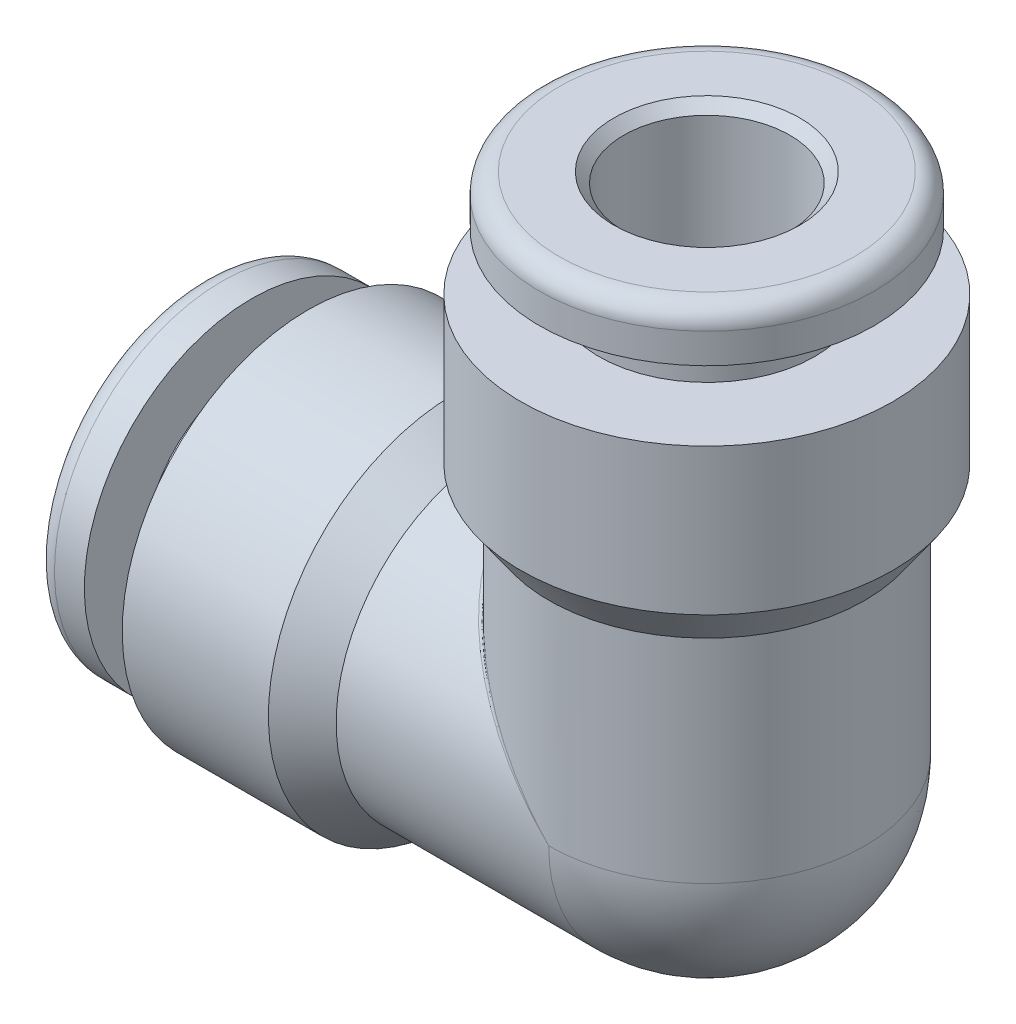
from build123d import *

# Parameters (mm, degrees)
CIRPATTERN1_COUNT  = 2
CIRPATTERN1_ANGLE  = 90
SKETCH5_R          = 2.69875
CUT_EXTRUDE3_DEPTH = 29.211156942
SKETCH6_R          = 2.69875
CUT_EXTRUDE4_DEPTH = 29.211156942
REVOLVE2_ANGLE     = 90
FILLET1_R          = 0.254


with BuildPart() as part:
    # Sketch1 → Revolve1 (revolve)
    with BuildSketch(Plane.XY):
        with BuildLine():
            Line((-15.24, 7.112), (-9.652, 7.112))
            Line((-9.652, 7.112), (-8.128451706, 6.0452))
            Line((-8.128451706, 6.0452), (0, 6.0452))
            Line((0, 6.0452), (0, 2.69875))
            Line((0, 2.69875), (-9.652, 2.69875))
            Line((-9.652, 2.69875), (-9.652, 3.175))
            Line((-9.652, 3.175), (-18.923, 3.175))
            Line((-18.923, 3.175), (-19.304, 3.556))
            Line((-19.304, 3.556), (-19.304, 5.6388))
            ThreePointArc((-19.304, 5.6388), (-19.080815367, 6.177615367), (-18.542, 6.4008))
            Line((-18.542, 6.4008), (-17.399, 6.4008))
            Line((-17.399, 6.4008), (-17.399, 4.1275))
            Line((-17.399, 4.1275), (-15.24, 4.1275))
            Line((-15.24, 4.1275), (-15.24, 7.112))
        make_face()
    revolve1 = revolve(axis=Axis((0, 0, 0), (-1, 0, 0)))

    # CirPattern1: Revolve1 ×2 about axis
    cirpattern1_axis = Axis((0, 0, -6.0452), (0, 0, -1))
    for i in range(1, CIRPATTERN1_COUNT):
        add(revolve1.rotate(cirpattern1_axis, i * CIRPATTERN1_ANGLE / (CIRPATTERN1_COUNT - 1)))

    # Sketch5 → Cut-Extrude3 (cut, through all)
    with BuildSketch(Plane.XZ):
        Circle(SKETCH5_R)
    extrude(amount=-CUT_EXTRUDE3_DEPTH, mode=Mode.SUBTRACT)

    # Sketch6 → Cut-Extrude4 (cut, through all)
    with BuildSketch(Plane(origin=(0, 0, 0), x_dir=(0, 0, -1), z_dir=(1, 0, 0))):
        with Locations(Location((0, 0, 0), (0, 0, 90))):
            Circle(SKETCH6_R)
    extrude(amount=-CUT_EXTRUDE4_DEPTH, mode=Mode.SUBTRACT)

    # Sketch7 → Revolve2 (revolve)
    with BuildSketch(Plane(origin=(0, 0, 0), x_dir=(0, 0, -1), z_dir=(1, 0, 0))):
        with BuildLine():
            Line((-2.69875, 0), (-6.0452, 0))
            ThreePointArc((-6.0452, 0), (0, -6.0452), (6.0452, 0))
            Line((6.0452, 0), (2.69875, 0))
            ThreePointArc((2.69875, 0), (0, -2.69875), (-2.69875, 0))
        make_face()
    revolve(axis=Axis((0, 0, -2.69875), (0, 0, 1)), revolution_arc=REVOLVE2_ANGLE)

    # Fillet1
    fillet1_edges = [part.edges().sort_by_distance(p)[0] for p in [
        (-3.905494855, 3.905494855, -4.614277081),
    ]]
    fillet(fillet1_edges, radius=FILLET1_R)


solid = part.part
